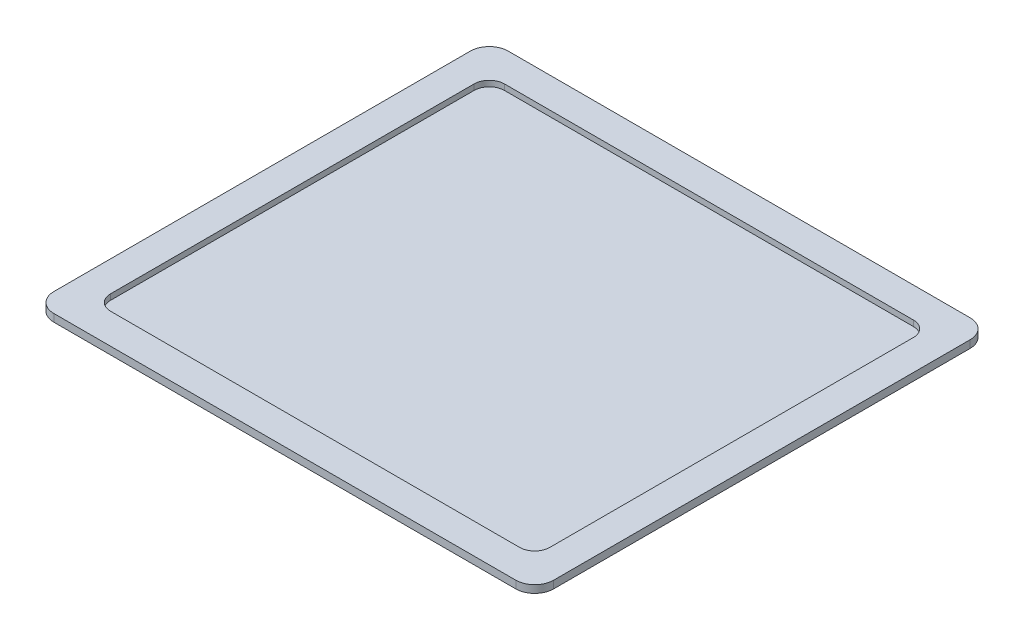
from build123d import *

# Parameters (mm, degrees)
RESSALTO_EXTRUS_O2_DEPTH = 10
RESSALTO_EXTRUS_O3_DEPTH = 2.5


with BuildPart() as part:
    # Esboço1 → Ressalto-extrusão2 (new body)
    with BuildSketch(Plane(origin=(0, 0, 0), x_dir=(1, 0, 0), z_dir=(0, 1, 0))):
        with BuildLine():
            Line((-305, -300), (305, -300))
            ThreePointArc((305, -300), (322.67766953, -292.67766953), (330, -275))
            Line((330, -275), (330, 275))
            ThreePointArc((330, 275), (322.67766953, 292.67766953), (305, 300))
            Line((305, 300), (-305, 300))
            ThreePointArc((-305, 300), (-322.67766953, 292.67766953), (-330, 275))
            Line((-330, 275), (-330, -275))
            ThreePointArc((-330, -275), (-322.67766953, -292.67766953), (-305, -300))
        make_face()
        with BuildLine():
            Line((270, -260), (-270, -260))
            ThreePointArc((-270, -260), (-284.142135624, -254.142135624), (-290, -240))
            Line((-290, -240), (-290, 240))
            ThreePointArc((-290, 240), (-284.142135624, 254.142135624), (-270, 260))
            Line((-270, 260), (270, 260))
            ThreePointArc((270, 260), (284.142135624, 254.142135624), (290, 240))
            Line((290, 240), (290, -240))
            ThreePointArc((290, -240), (284.142135624, -254.142135624), (270, -260))
        make_face(mode=Mode.SUBTRACT)
    extrude(amount=RESSALTO_EXTRUS_O2_DEPTH)

    # Esboço2 → Ressalto-extrusão3 (add, symmetric)
    with BuildSketch(Plane(origin=(0, 0, 0), x_dir=(1, 0, 0), z_dir=(0, 1, 0))):
        with BuildLine():
            Line((300, -240), (300, 240))
            ThreePointArc((300, 240), (291.213203436, 261.213203436), (270, 270))
            Line((270, 270), (-270, 270))
            ThreePointArc((-270, 270), (-291.213203436, 261.213203436), (-300, 240))
            Line((-300, 240), (-300, -240))
            ThreePointArc((-300, -240), (-291.213203436, -261.213203436), (-270, -270))
            Line((-270, -270), (270, -270))
            ThreePointArc((270, -270), (291.213203436, -261.213203436), (300, -240))
        make_face()
    extrude(amount=RESSALTO_EXTRUS_O3_DEPTH, both=True)


solid = part.part
